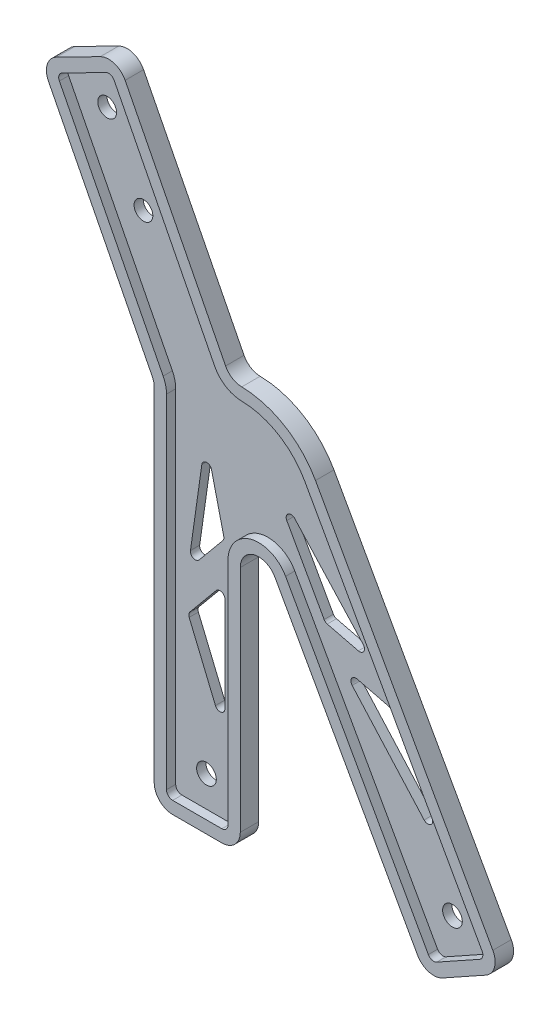
from build123d import *

# Parameters (mm, degrees)
SCHIZZO2_R                   = 1.6
SCHIZZO2_R_2                 = 1.525
ESTRUSIONE_ESTRUSIONE1_DEPTH = 1.5
RACCORDO1_R                  = 3
TAGLIO_ESTRUSIONE1_DEPTH     = 161.918381387
ESTRUSIONE_ESTRUSIONE2_START = -1.5
ESTRUSIONE_ESTRUSIONE2_DEPTH = 1.5
RACCORDO2_R                  = 0.8


with BuildPart() as part:
    # Schizzo2 → Estrusione-Estrusione1 (new body)
    with BuildSketch(Plane.XY):
        with BuildLine():
            Line((10.835450111, 45.456844872), (10.835450111, 104.878132603))
            Line((10.835450111, 104.878132603), (-7.726239407, 141.30749945))
            Line((-7.726239407, 141.30749945), (4.747851932, 147.663366447))
            Line((4.747851932, 147.663366447), (23.319883285, 111.213702604))
            ThreePointArc((23.319883285, 111.213702604), (31.262689996, 109.733445118), (37.064853942, 104.110791454))
            Line((37.064853942, 104.110791454), (67.357558736, 49.749549666))
            Line((67.357558736, 49.749549666), (55.128154906, 42.934736247))
            Line((55.128154906, 42.934736247), (24.835450111, 97.295978034))
            Line((24.835450111, 97.295978034), (24.835450111, 45.456844872))
            Line((24.835450111, 45.456844872), (10.835450111, 45.456844872))
        make_face()
        with Locations((17.835450111, 52.456844872)):
            Circle(SCHIZZO2_R, mode=Mode.SUBTRACT)
        with Locations((57.835450111, 52.456844872)):
            Circle(SCHIZZO2_R, mode=Mode.SUBTRACT)
        with Locations((1.688739761, 138.248387279)):
            Circle(SCHIZZO2_R_2, mode=Mode.SUBTRACT)
        with Locations((7.590616257, 126.665302465)):
            Circle(SCHIZZO2_R_2, mode=Mode.SUBTRACT)
    extrude(amount=ESTRUSIONE_ESTRUSIONE1_DEPTH)

    # Raccordo1
    raccordo1_edges = [part.edges().sort_by_distance(p)[0] for p in [
        (10.835450111, 45.456844872, 0.75),
        (10.835450111, 104.878132603, 0.75),
        (-7.726239407, 141.30749945, 0.75),
        (4.747851932, 147.663366447, 0.75),
        (23.319883285, 111.213702604, 0.75),
        (67.357558736, 49.749549666, 0.75),
        (55.128154906, 42.934736247, 0.75),
        (24.835450111, 97.295978034, 0.75),
        (24.835450111, 45.456844872, 0.75),
    ]]
    fillet(raccordo1_edges, radius=RACCORDO1_R)

    # Schizzo3 → Taglio-Estrusione1 (cut, through all)
    with BuildSketch(Plane(origin=(0, 0, 0), x_dir=(-1, 0, 0), z_dir=(0, 0, -1))):
        Polygon((-58.032865762, 58.26562082), (-47.760114135, 76.700406977), (-39.799110822, 78.660596286), align=None)
        Polygon((-45.099489196, 81.47498477), (-37.138485884, 83.435174078), (-27.576187875, 100.595028163), align=None)
        Polygon((-14.835450111, 73.513329832), (-20.835450111, 59.080649935), (-20.835450111, 80.754828538), align=None)
        Polygon((-20.736858212, 86.90531457), (-17.675265193, 99.811833972), (-14.835450111, 79.782808049), align=None)
    extrude(amount=-TAGLIO_ESTRUSIONE1_DEPTH, mode=Mode.SUBTRACT)

    # Schizzo4 → Estrusione-Estrusione2 (add)
    with BuildSketch(Plane(origin=(0, 0, 1.5), x_dir=(-1, 0, 0), z_dir=(0, 0, -1)).offset(ESTRUSIONE_ESTRUSIONE2_START)):
        with BuildLine():
            Line((5.053219834, 142.669470949), (-2.074832359, 146.301394947))
            ThreePointArc((-2.074832359, 146.301394947), (-4.363854842, 146.481544924), (-6.109823431, 144.990346874))
            Line((-6.109823431, 144.990346874), (-22.444537387, 112.93166566))
            ThreePointArc((-22.444537387, 112.93166566), (-23.528890764, 111.74881109), (-25.067773398, 111.294050255))
            ThreePointArc((-25.067773398, 111.294050255), (-32.027352671, 109.307494906), (-37.064853942, 104.110791454))
            Line((-37.064853942, 104.110791454), (-65.897241575, 52.370136202))
            ThreePointArc((-65.897241575, 52.370136202), (-66.162289717, 50.089384698), (-64.736972201, 48.289232505))
            Line((-64.736972201, 48.289232505), (-57.748741441, 44.395053408))
            ThreePointArc((-57.748741441, 44.395053408), (-55.467989937, 44.130005266), (-53.667837744, 45.555322782))
            Line((-53.667837744, 45.555322782), (-30.456036646, 87.209653102))
            ThreePointArc((-30.456036646, 87.209653102), (-27.081049556, 88.652933675), (-24.835450111, 85.749335941))
            Line((-24.835450111, 85.749335941), (-24.835450111, 48.456844872))
            ThreePointArc((-24.835450111, 48.456844872), (-23.956770454, 46.335524528), (-21.835450111, 45.456844872))
            Line((-21.835450111, 45.456844872), (-13.835450111, 45.456844872))
            ThreePointArc((-13.835450111, 45.456844872), (-11.714129767, 46.335524528), (-10.835450111, 48.456844872))
            Line((-10.835450111, 48.456844872), (-10.835450111, 104.157896326))
            ThreePointArc((-10.835450111, 104.157896326), (-10.752559872, 104.858232417), (-10.508469683, 105.519867825))
            Line((-10.508469683, 105.519867825), (6.364267908, 138.634479878))
            ThreePointArc((6.364267908, 138.634479878), (6.544417884, 140.92350236), (5.053219834, 142.669470949))
        make_face()
        with BuildLine():
            Line((-35.317796251, 103.13724668), (-64.150183885, 51.396591427))
            ThreePointArc((-64.150183885, 51.396591427), (-64.238533265, 50.636340926), (-63.763427427, 50.036290195))
            Line((-63.763427427, 50.036290195), (-56.775196666, 46.142111098))
            ThreePointArc((-56.775196666, 46.142111098), (-56.014946165, 46.053761717), (-55.414895434, 46.528867556))
            Line((-55.414895434, 46.528867556), (-32.203094336, 88.183197876))
            ThreePointArc((-32.203094336, 88.183197876), (-26.578115853, 90.588665498), (-22.835450111, 85.749335941))
            Line((-22.835450111, 85.749335941), (-22.835450111, 48.456844872))
            ThreePointArc((-22.835450111, 48.456844872), (-22.542556892, 47.749738091), (-21.835450111, 47.456844872))
            Line((-21.835450111, 47.456844872), (-13.835450111, 47.456844872))
            ThreePointArc((-13.835450111, 47.456844872), (-13.12834333, 47.749738091), (-12.835450111, 48.456844872))
            Line((-12.835450111, 48.456844872), (-12.835450111, 104.157896326))
            ThreePointArc((-12.835450111, 104.157896326), (-12.697299713, 105.325123145), (-12.290482732, 106.427848824))
            Line((-12.290482732, 106.427848824), (4.582254859, 139.542460877))
            ThreePointArc((4.582254859, 139.542460877), (4.642304851, 140.305468371), (4.145238835, 140.887457901))
            Line((4.145238835, 140.887457901), (-2.982813359, 144.519381899))
            ThreePointArc((-2.982813359, 144.519381899), (-3.745820853, 144.579431891), (-4.327810383, 144.082365875))
            Line((-4.327810383, 144.082365875), (-20.662524339, 112.02368466))
            ThreePointArc((-20.662524339, 112.02368466), (-22.469779967, 110.052260378), (-25.034584357, 109.294325652))
            ThreePointArc((-25.034584357, 109.294325652), (-30.99993802, 107.591563924), (-35.317796251, 103.13724668))
        make_face(mode=Mode.SUBTRACT)
    extrude(amount=ESTRUSIONE_ESTRUSIONE2_DEPTH)

    # Raccordo2
    raccordo2_edges = [part.edges().sort_by_distance(p)[0] for p in [
        (39.799110822, 78.660596286, 0.75),
        (58.032865762, 58.26562082, 0.75),
        (47.760114135, 76.700406977, 0.75),
        (45.099489196, 81.47498477, 0.75),
        (27.576187875, 100.595028163, 0.75),
        (37.138485884, 83.435174078, 0.75),
        (20.835450111, 80.754828538, 0.75),
        (14.835450111, 73.513329832, 0.75),
        (20.835450111, 59.080649935, 0.75),
        (14.835450111, 79.782808049, 0.75),
        (20.736858212, 86.90531457, 0.75),
        (17.675265193, 99.811833972, 0.75),
    ]]
    fillet(raccordo2_edges, radius=RACCORDO2_R)


solid = part.part
